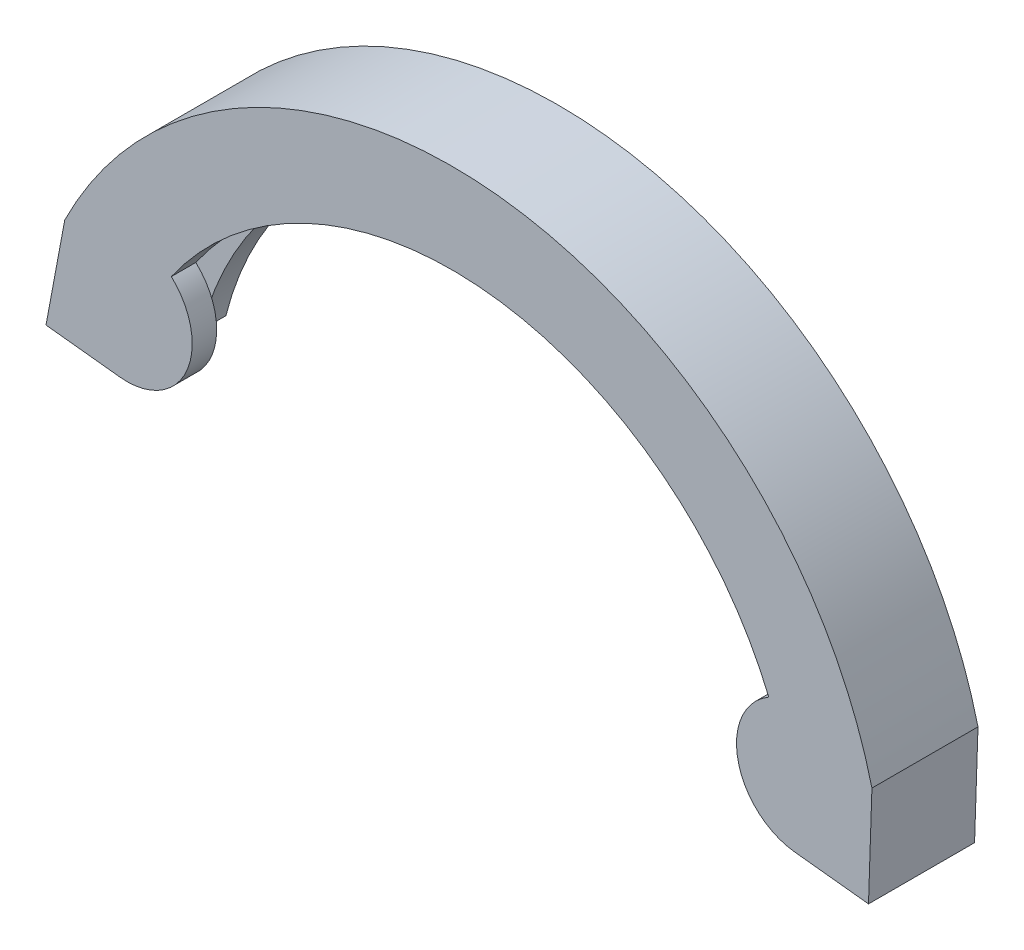
from build123d import *

# Parameters (mm, degrees)
SKETCH1_W                    = 50
SKETCH1_H                    = 7
REVOLVE5_ANGLE               = 167.5
SHELL2_T                     = 3
CUT_EXTRUDE3_DEPTH           = 77.072333999
CUT_EXTRUDE3_DEPTH_BACK      = 10
CUT_EXTRUDE4_DEPTH           = 77.072333999
CUT_EXTRUDE4_DEPTH_BACK      = 10
CUT_EXTRUDE_THIN1_DEPTH      = 77.072333999
CUT_EXTRUDE_THIN1_DEPTH_BACK = 20
CUT_EXTRUDE_THIN2_DEPTH      = 77.072333999
CUT_EXTRUDE_THIN2_DEPTH_BACK = 20
CUT_EXTRUDE_THIN3_DEPTH      = 76.000787866
CUT_EXTRUDE_THIN3_DEPTH_BACK = 20
SKETCH18_R                   = 8
BOSS_EXTRUDE3_DEPTH          = 3
SKETCH22_W                   = 13
SKETCH22_H                   = 12.488136332
BOSS_EXTRUDE4_DEPTH          = 1
SKETCH23_W                   = 13
SKETCH23_H                   = 12.478928716
BOSS_EXTRUDE5_DEPTH          = 1
CUT_EXTRUDE_THIN4_DEPTH      = 76.647331154
CUT_EXTRUDE_THIN4_DEPTH_BACK = 20
CUT_EXTRUDE_THIN5_DEPTH      = 76.000787866
CUT_EXTRUDE_THIN5_DEPTH_BACK = 20


with BuildPart() as part:
    # Sketch1 → Revolve5 (revolve)
    with BuildSketch(Plane(origin=(0, 0, 0), x_dir=(1, 0, 0), z_dir=(0, 1, 0))):
        with Locations((25, 3.5)):
            Rectangle(SKETCH1_W, SKETCH1_H)
    revolve(axis=Axis((0, 0, 0), (0, 0, 1)), revolution_arc=REVOLVE5_ANGLE)

    # Shell2
    shell2_openings = [part.faces().sort_by_distance(p)[0] for p in [
        (25, 0, -3.5),
        (-24.407400178, 5.410990348, -3.5),
    ]]
    offset(amount=SHELL2_T, openings=shell2_openings, kind=Kind.INTERSECTION)

    # Sketch11 → Cut-Extrude3 (cut, two sides: drawn at the far end of the back side and taken through both)
    with BuildSketch(Plane.XY.offset(3).offset(-CUT_EXTRUDE3_DEPTH_BACK)):
        Polygon((-295.067343662, 38.119573796), (-51.743688377, 11.471299539), (53, 0), (296.323655284, -26.648274258), (243.027106769, -513.295584826), (-348.363892177, -448.527736772), align=None)
    extrude(amount=CUT_EXTRUDE3_DEPTH + CUT_EXTRUDE3_DEPTH_BACK, mode=Mode.SUBTRACT)

    # Sketch12 → Cut-Extrude4 (cut, two sides: drawn at the far end of the back side and taken through both)
    with BuildSketch(Plane(origin=(0, 0, -10), x_dir=(-1, 0, 0), z_dir=(0, 0, -1)).offset(-CUT_EXTRUDE4_DEPTH_BACK)):
        Polygon((-296.323655284, -26.648274258), (-53, 0), (51.743688377, 11.471299539), (295.067343662, 38.119573796), (348.363892177, -448.527736772), (-243.027106769, -513.295584826), align=None)
    extrude(amount=CUT_EXTRUDE4_DEPTH + CUT_EXTRUDE4_DEPTH_BACK, mode=Mode.SUBTRACT)

    # Sketch13 → Cut-Extrude-Thin1 (cut, two sides: drawn at the far end of the back side and taken through both)
    with BuildSketch(Plane(origin=(0, 0, -10), x_dir=(-1, 0, 0), z_dir=(0, 0, -1)).offset(-CUT_EXTRUDE_THIN1_DEPTH_BACK)):
        Polygon((48.779244367, 11.146640118), (47.419699991, 23.560551191), (57.360263374, 24.64921994), (58.719807749, 12.235308866), align=None)
    extrude(amount=CUT_EXTRUDE_THIN1_DEPTH + CUT_EXTRUDE_THIN1_DEPTH_BACK, mode=Mode.SUBTRACT)

    # Sketch14 → Cut-Extrude-Thin2 (cut, two sides: drawn at the far end of the back side and taken through both)
    with BuildSketch(Plane(origin=(0, 0, -10), x_dir=(-1, 0, 0), z_dir=(0, 0, -1)).offset(-CUT_EXTRUDE_THIN2_DEPTH_BACK)):
        Polygon((-50.035555989, 0.324659421), (-51.39409796, 12.729417605), (-81.215788107, 9.46341136), (-79.857246136, -2.941346825), align=None)
    extrude(amount=CUT_EXTRUDE_THIN2_DEPTH + CUT_EXTRUDE_THIN2_DEPTH_BACK, mode=Mode.SUBTRACT)

    # Sketch15 → Cut-Extrude-Thin3 (cut, two sides: drawn at the far end of the back side and taken through both)
    with BuildSketch(Plane(origin=(0, 0, -10), x_dir=(-1, 0, 0), z_dir=(0, 0, -1)).offset(-CUT_EXTRUDE_THIN3_DEPTH_BACK)):
        with BuildLine():
            ThreePointArc((-41.982664634, 1.20659446), (-4.572408744, 41.750366205), (40.726353012, 10.264705079))
            Line((40.726353012, 10.264705079), (11.636100861, 2.93277288))
            ThreePointArc((11.636100861, 2.93277288), (-1.306402498, 11.928676059), (-11.995047038, 0.344741274))
            Line((-11.995047038, 0.344741274), (-41.982664634, 1.20659446))
        make_face()
    extrude(amount=CUT_EXTRUDE_THIN3_DEPTH + CUT_EXTRUDE_THIN3_DEPTH_BACK, mode=Mode.SUBTRACT)


with BuildPart() as body_2:
    # of the pieces the cut leaves, the one that is kept (cut_extrude_thin3_keep)
    add(part.part.solids().sort_by_distance((49.998919737, 0.328671743, 0))[0])

    # Sketch18 → Boss-Extrude3 (add)
    with BuildSketch(Plane.XY.offset(3)):
        with Locations((-39.855418013, 18.217155785)):
            Circle(SKETCH18_R)
        with Locations((42.853599633, 9.159045166)):
            Circle(SKETCH18_R)
    extrude(amount=-BOSS_EXTRUDE3_DEPTH)

    # Sketch22 → Boss-Extrude4 (add)
    with BuildSketch(Plane(origin=(-49.407400178, 5.410990348, 0), x_dir=(0, 0, 1), z_dir=(-0.99405633822232, 0.10886687485196148, 0))):
        with Locations((-3.5, 12.014012533)):
            Rectangle(SKETCH22_W, SKETCH22_H)
    extrude(amount=BOSS_EXTRUDE4_DEPTH)

    # Sketch23 → Boss-Extrude5 (add)
    with BuildSketch(Plane(origin=(49.407400178, -5.410990348, 0), x_dir=(0, 0, -1), z_dir=(0.9940563382223201, -0.10886687485196078, 0))):
        with Locations((3.5, 12.009408725)):
            Rectangle(SKETCH23_W, SKETCH23_H)
    extrude(amount=BOSS_EXTRUDE5_DEPTH)

    # Sketch25 → Cut-Extrude-Thin4 (cut, two sides: drawn at the far end of the back side and taken through both)
    with BuildSketch(Plane(origin=(0, 0, -10), x_dir=(-1, 0, 0), z_dir=(0, 0, -1)).offset(-CUT_EXTRUDE_THIN4_DEPTH_BACK)):
        Polygon((-51.450152385, 12.723278647), (-51.029612328, 0.215792546), (-61.023964562, -0.12024824), (-61.44450462, 12.387237861), align=None)
    extrude(amount=CUT_EXTRUDE_THIN4_DEPTH + CUT_EXTRUDE_THIN4_DEPTH_BACK, mode=Mode.SUBTRACT)

    # Sketch26 → Cut-Extrude-Thin5 (cut, two sides: drawn at the far end of the back side and taken through both)
    with BuildSketch(Plane.XY.offset(3).offset(-CUT_EXTRUDE_THIN5_DEPTH_BACK)):
        Polygon((-47.472396692, 23.566322419), (-49.773300705, 11.255506993), (-59.603087399, 13.092704194), (-57.302183385, 25.40351962), align=None)
    extrude(amount=CUT_EXTRUDE_THIN5_DEPTH + CUT_EXTRUDE_THIN5_DEPTH_BACK, mode=Mode.SUBTRACT)


solid = body_2.part
